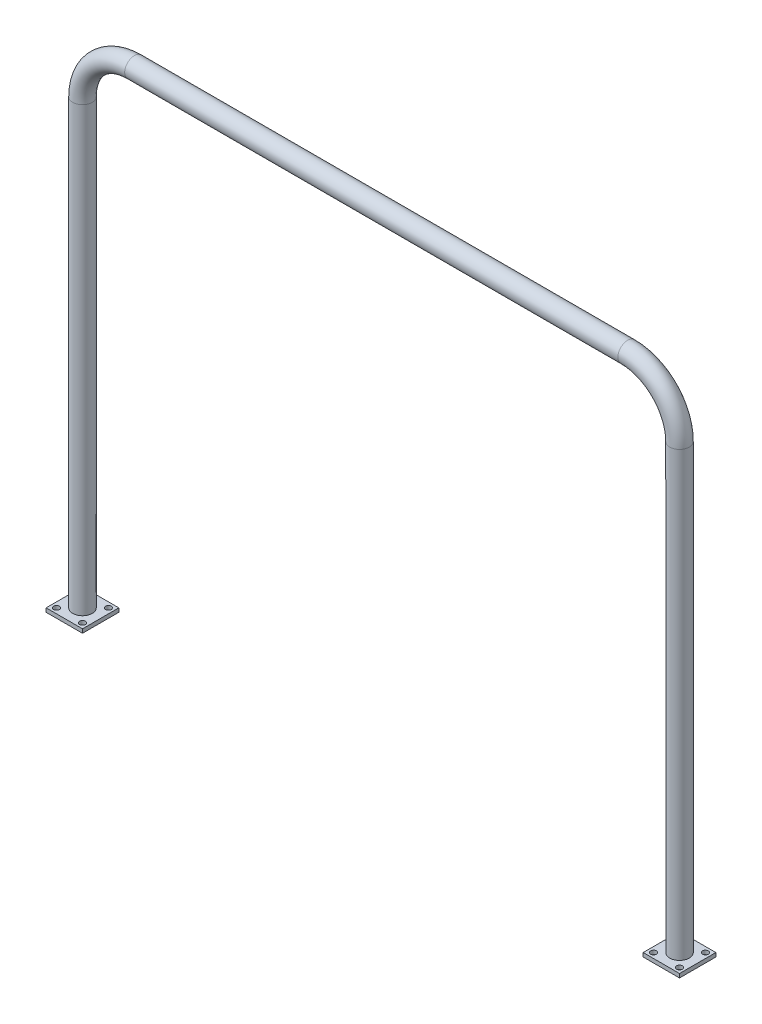
from build123d import *

# Parameters (mm, degrees)
SKETCH2_R                     = 15
SKETCH3_W                     = 56
SKETCH3_H                     = 56
BOSS_EXTRUDE1_DEPTH           = 6
M8_CLEARANCE_HOLE1_AT_2_COUNT = 2
M8_CLEARANCE_HOLE1_AT_2_PITCH = 56.568542495
M8_CLEARANCE_HOLE1_AT_3_COUNT = 2
M8_CLEARANCE_HOLE1_AT_3_PITCH = 40
M8_CLEARANCE_HOLE1_AT_4_COUNT = 2
M8_CLEARANCE_HOLE1_AT_4_PITCH = 40


with BuildPart() as part:
    # Sweep1: sweep along a path in Sketch1
    with BuildLine(Plane.XY) as sweep1_path:
        Line((-460, 0), (-460, 682))
        ThreePointArc((-460, 682), (-436.568542495, 738.568542495), (-380, 762))
        Line((-380, 762), (380, 762))
        ThreePointArc((380, 762), (436.568542495, 738.568542495), (460, 682))
        Line((460, 682), (460, 0))
    # Sketch2 → Sweep1 (sweep)
    with BuildSketch(Plane(origin=(0, 0, 0), x_dir=(1, 0, 0), z_dir=(0, 1, 0))):
        with Locations((-460, 0)):
            Circle(SKETCH2_R)
    sweep(path=sweep1_path.line)

    # Sketch3 → Boss-Extrude1 (add)
    with BuildSketch(Plane.XZ):
        with Locations((-460, 0)):
            Rectangle(SKETCH3_W, SKETCH3_H)
    boss_extrude1 = extrude(amount=BOSS_EXTRUDE1_DEPTH)

    # Sketch7 → M8 Clearance Hole1 (revolve, cut)
    with BuildSketch(Plane(origin=(-440, 0, 20), x_dir=(0, 0, 1), z_dir=(1, 0, 0))):
        Polygon((0, 0), (0, 25.703872786), (4.5, 23), (4.5, 0), align=None)
    m8_clearance_hole1 = revolve(axis=Axis((-440, 6.35, 20), (0, -1, 0)), mode=Mode.SUBTRACT)

    # M8 Clearance Hole1 at 2: M8 Clearance Hole1 ×2
    with Locations(*[Vector(-0.7071067811865477, 0, -0.7071067811865474) * (i * M8_CLEARANCE_HOLE1_AT_2_PITCH) for i in range(1, M8_CLEARANCE_HOLE1_AT_2_COUNT)]):
        add(m8_clearance_hole1, mode=Mode.SUBTRACT)

    # M8 Clearance Hole1 at 3: M8 Clearance Hole1 ×2
    with Locations(*[(-i * M8_CLEARANCE_HOLE1_AT_3_PITCH, 0, 0) for i in range(1, M8_CLEARANCE_HOLE1_AT_3_COUNT)]):
        add(m8_clearance_hole1, mode=Mode.SUBTRACT)

    # M8 Clearance Hole1 at 4: M8 Clearance Hole1 ×2
    with Locations(*[(0, 0, -i * M8_CLEARANCE_HOLE1_AT_4_PITCH) for i in range(1, M8_CLEARANCE_HOLE1_AT_4_COUNT)]):
        add(m8_clearance_hole1, mode=Mode.SUBTRACT)

    # Mirror1: Boss-Extrude1, M8 Clearance Hole1 across plane
    add(boss_extrude1.mirror(Plane(origin=(0, 0, 0), x_dir=(0, 0, 1), z_dir=(1, 0, 0))))
    add(m8_clearance_hole1.mirror(Plane(origin=(0, 0, 0), x_dir=(0, 0, 1), z_dir=(1, 0, 0))), mode=Mode.SUBTRACT)

    # Mirror1 copy 1 sketch → Mirror1 copy 1 (revolve, cut)
    with BuildSketch(Plane(origin=(480, 0, -20), x_dir=(0, 0, 1), z_dir=(-1, 0, 0))):
        Polygon((0, 0), (0, -25.703872786), (4.5, -23), (4.5, 0), align=None)
    revolve(axis=Axis((480, 6.35, -20), (0, 1, 0)), mode=Mode.SUBTRACT)

    # Mirror1 copy 2 sketch → Mirror1 copy 2 (revolve, cut)
    with BuildSketch(Plane(origin=(480, 0, 20), x_dir=(0, 0, 1), z_dir=(-1, 0, 0))):
        Polygon((0, 0), (0, -25.703872786), (4.5, -23), (4.5, 0), align=None)
    revolve(axis=Axis((480, 6.35, 20), (0, 1, 0)), mode=Mode.SUBTRACT)

    # Mirror1 copy 3 sketch → Mirror1 copy 3 (revolve, cut)
    with BuildSketch(Plane(origin=(440, 0, -20), x_dir=(0, 0, 1), z_dir=(-1, 0, 0))):
        Polygon((0, 0), (0, -25.703872786), (4.5, -23), (4.5, 0), align=None)
    revolve(axis=Axis((440, 6.35, -20), (0, 1, 0)), mode=Mode.SUBTRACT)


solid = part.part
